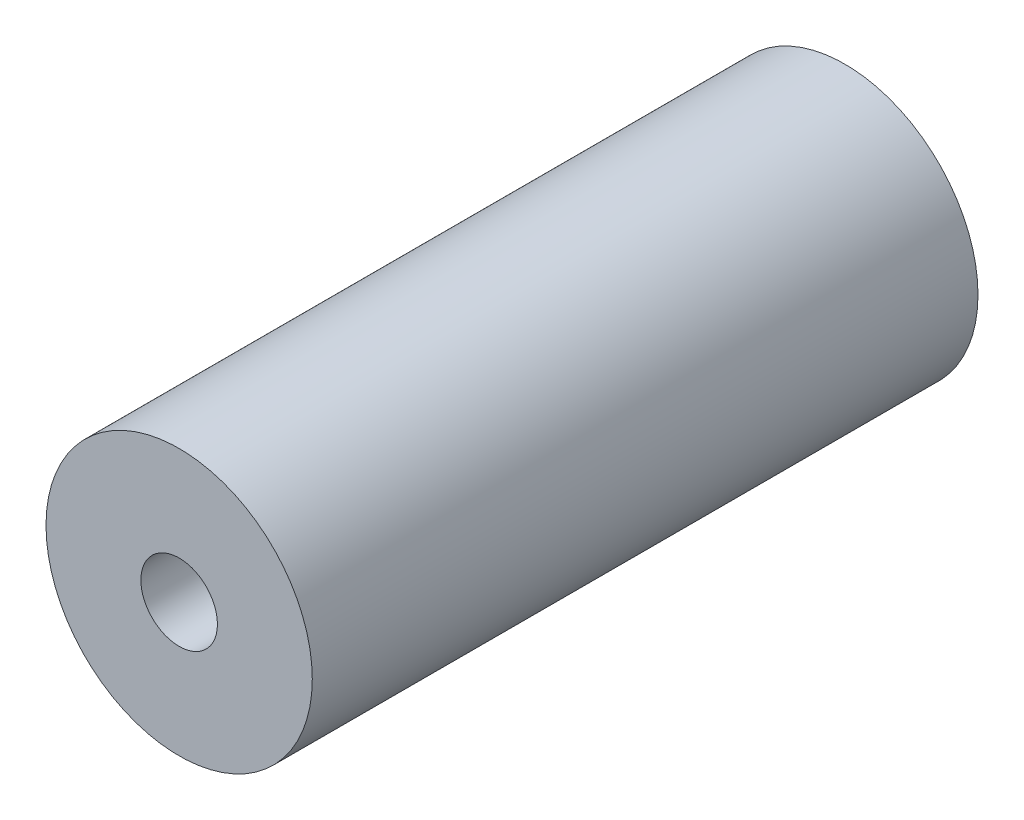
from build123d import *

# Parameters (mm, degrees)
SKETCH1_R           = 4
SKETCH1_R_2         = 1.15
BOSS_EXTRUDE1_DEPTH = 20
SKETCH2_R           = 1.25
CUT_EXTRUDE1_DEPTH  = 10


with BuildPart() as part:
    # Sketch1 → Boss-Extrude1 (new body)
    with BuildSketch(Plane.XY):
        Circle(SKETCH1_R)
        Circle(SKETCH1_R_2, mode=Mode.SUBTRACT)
    extrude(amount=BOSS_EXTRUDE1_DEPTH)

    # Sketch2 → Cut-Extrude1 (cut)
    with BuildSketch(Plane(origin=(0, 0, 0), x_dir=(1, 0, 0), z_dir=(0, 1, 0))):
        with Locations(Location((0, -8.5, 0), (0, 0, 270))):
            Circle(SKETCH2_R)
    extrude(amount=-CUT_EXTRUDE1_DEPTH, mode=Mode.SUBTRACT)


solid = part.part
